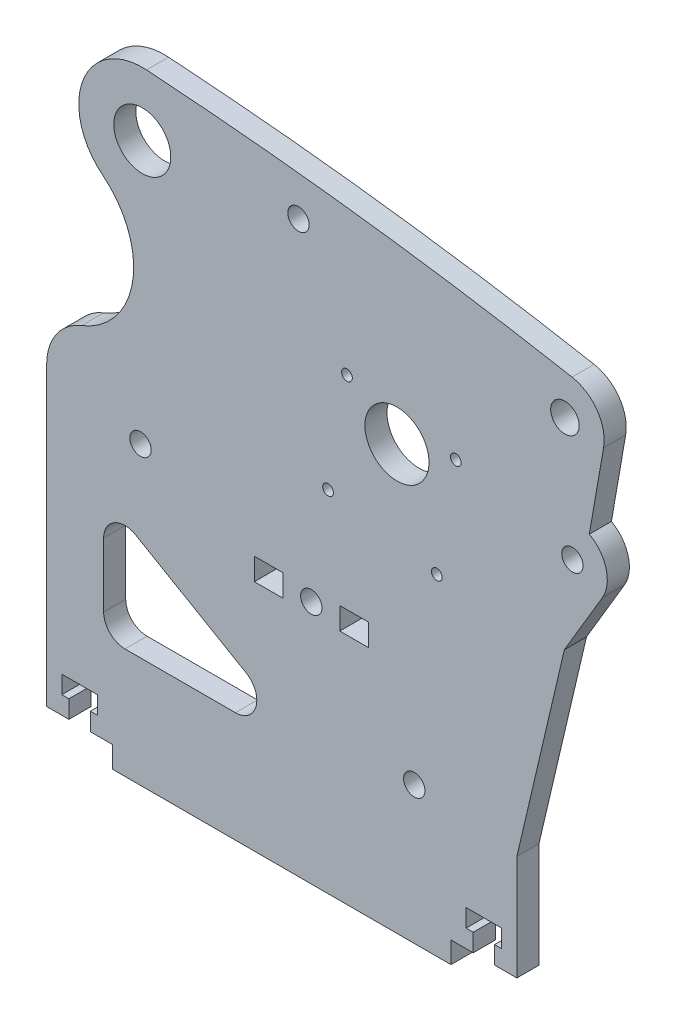
from build123d import *

# Parameters (mm, degrees)
SKETCH1_R           = 4
SKETCH1_R_2         = 8
SKETCH1_R_3         = 3
SKETCH1_R_4         = 9
BOSS_EXTRUDE1_DEPTH = 6.2
CUT_EXTRUDE1_REACH  = 156.506
SKETCH2_R           = 1.5
CUT_EXTRUDE2_REACH  = 156.506
CUT_EXTRUDE3_REACH  = 156.506
SKETCH4_R           = 3
SKETCH4_W           = 8
SKETCH4_H           = 6.2


with BuildPart() as part:
    # Sketch1 → Boss-Extrude1 (new body)
    with BuildSketch(Plane.XY):
        with BuildLine():
            Line((33.65, -83.5), (47, -26.5))
            Line((47, -26.5), (57.678304402, -8.5))
            ThreePointArc((57.678304402, -8.5), (58.708572703, -0.936463864), (54, 5.071686829))
            Line((54, 5.071686829), (58, 28.071686829))
            ThreePointArc((58, 28.071686829), (56.207110337, 36.277710094), (49.152329455, 40.836584722))
            ThreePointArc((49.152329455, 40.836584722), (-10.365453902, 50.052003716), (-70.318491494, 55.789927265))
            ThreePointArc((-70.318491494, 55.789927265), (-88.125314746, 44.440216148), (-82.611172846, 24.056567409))
            ThreePointArc((-82.611172846, 24.056567409), (-74.166284142, 2.579562371), (-88.533690885, -15.480213766))
            ThreePointArc((-88.533690885, -15.480213766), (-95.663024793, -21.178356395), (-98.35, -29.900534772))
            Line((-98.35, -29.900534772), (-98.35, -113))
            Line((-98.35, -113), (-79.85, -113))
            Line((-79.85, -113), (-79.85, -119))
            Line((-79.85, -119), (15.15, -119))
            Line((15.15, -119), (15.15, -113))
            Line((15.15, -113), (33.65, -113))
            Line((33.65, -113), (33.65, -83.5))
        make_face()
        with Locations(Location((47.15, 30, 0), (0, 0, 180))):
            Circle(SKETCH1_R, mode=Mode.SUBTRACT)
        with Locations(Location((-71.5, 38, 0), (0, 0, 180))):
            Circle(SKETCH1_R_2, mode=Mode.SUBTRACT)
        with Locations(Location((-27.65, 40.9, 0), (0, 0, 180))):
            Circle(SKETCH1_R_3, mode=Mode.SUBTRACT)
        with Locations(Location((4.85, -80.4, 0), (0, 0, 180))):
            Circle(SKETCH1_R_3, mode=Mode.SUBTRACT)
        with Locations(Location((49.25, -3.5, 0), (0, 0, 180))):
            Circle(SKETCH1_R_3, mode=Mode.SUBTRACT)
        with Locations(Location((-72, -36, 0), (0, 0, 180))):
            Circle(SKETCH1_R_3, mode=Mode.SUBTRACT)
        with Locations(Location((0, 0, 0), (0, 0, 180))):
            Circle(SKETCH1_R_4, mode=Mode.SUBTRACT)
        with BuildLine():
            Line((-82.35, -64), (-82.35, -82))
            ThreePointArc((-82.35, -82), (-80.592640687, -86.242640687), (-76.35, -88))
            Line((-76.35, -88), (-45.35, -88))
            ThreePointArc((-45.35, -88), (-39.556365472, -83.560063768), (-42.337186896, -76.81126632))
            Line((-42.337186896, -76.81126632), (-73.337186896, -58.81126632))
            ThreePointArc((-73.337186896, -58.81126632), (-79.343586593, -58.800150068), (-82.35, -64))
        make_face(mode=Mode.SUBTRACT)
    extrude(amount=BOSS_EXTRUDE1_DEPTH)

    # Sketch2 → Cut-Extrude1 (cut, up to next)
    with BuildSketch(Plane.XY.offset(6.2), mode=Mode.PRIVATE) as cut_extrude1_sk1:
        with Locations((-19.348702159, -20.792251556)):
            Circle(SKETCH2_R)
    cut_extrude1_tool1 = extrude(cut_extrude1_sk1.sketch, amount=-CUT_EXTRUDE1_REACH, mode=Mode.PRIVATE) & part.part
    # Sketch2 → Cut-Extrude1 (cut, up to next)
    with BuildSketch(Plane.XY.offset(6.2), mode=Mode.PRIVATE) as cut_extrude1_sk2:
        with Locations((11.192862241, -26.103827973)):
            Circle(SKETCH2_R)
    cut_extrude1_tool2 = extrude(cut_extrude1_sk2.sketch, amount=-CUT_EXTRUDE1_REACH, mode=Mode.PRIVATE) & part.part
    # Sketch2 → Cut-Extrude1 (cut, up to next)
    with BuildSketch(Plane.XY.offset(6.2), mode=Mode.PRIVATE) as cut_extrude1_sk3:
        with Locations((-14.037125741, 9.749312843)):
            Circle(SKETCH2_R)
    cut_extrude1_tool3 = extrude(cut_extrude1_sk3.sketch, amount=-CUT_EXTRUDE1_REACH, mode=Mode.PRIVATE) & part.part
    # Sketch2 → Cut-Extrude1 (cut, up to next)
    with BuildSketch(Plane.XY.offset(6.2), mode=Mode.PRIVATE) as cut_extrude1_sk4:
        with Locations((16.504438658, 4.437736426)):
            Circle(SKETCH2_R)
    cut_extrude1_tool4 = extrude(cut_extrude1_sk4.sketch, amount=-CUT_EXTRUDE1_REACH, mode=Mode.PRIVATE) & part.part
    add(cut_extrude1_tool1.solids().sort_by_distance((-19.348702, -20.792252, 6.2))[0], mode=Mode.SUBTRACT)
    add(cut_extrude1_tool2.solids().sort_by_distance((11.192862, -26.103828, 6.2))[0], mode=Mode.SUBTRACT)
    add(cut_extrude1_tool3.solids().sort_by_distance((-14.037126, 9.749313, 6.2))[0], mode=Mode.SUBTRACT)
    add(cut_extrude1_tool4.solids().sort_by_distance((16.504439, 4.437736, 6.2))[0], mode=Mode.SUBTRACT)

    # Sketch3 → Cut-Extrude2 (cut, up to next)
    with BuildSketch(Plane(origin=(0, 0, 0), x_dir=(-1, 0, 0), z_dir=(0, 0, -1)), mode=Mode.PRIVATE) as cut_extrude2_sk1:
        Polygon((-29.4, -103), (-19.4, -103), (-19.4, -108), (-21.4, -108), (-21.4, -113), (-27.4, -113), (-27.4, -108), (-29.4, -108), align=None)
    cut_extrude2_tool1 = extrude(cut_extrude2_sk1.sketch, amount=-CUT_EXTRUDE2_REACH, mode=Mode.PRIVATE) & part.part
    # Sketch3 → Cut-Extrude2 (cut, up to next)
    with BuildSketch(Plane(origin=(0, 0, 0), x_dir=(-1, 0, 0), z_dir=(0, 0, -1)), mode=Mode.PRIVATE) as cut_extrude2_sk2:
        Polygon((92.1, -113), (86.1, -113), (86.1, -108), (84.1, -108), (84.1, -103), (94.1, -103), (94.1, -108), (92.1, -108), align=None)
    cut_extrude2_tool2 = extrude(cut_extrude2_sk2.sketch, amount=-CUT_EXTRUDE2_REACH, mode=Mode.PRIVATE) & part.part
    add(cut_extrude2_tool1.solids().sort_by_distance((24.4, -107.375, 0))[0], mode=Mode.SUBTRACT)
    add(cut_extrude2_tool2.solids().sort_by_distance((-89.1, -107.375, 0))[0], mode=Mode.SUBTRACT)

    # Sketch4 → Cut-Extrude3 (cut, up to next)
    with BuildSketch(Plane.XY.offset(6.2), mode=Mode.PRIVATE) as cut_extrude3_sk1:
        with Locations((-24.05, -50.4)):
            Circle(SKETCH4_R)
    cut_extrude3_tool1 = extrude(cut_extrude3_sk1.sketch, amount=-CUT_EXTRUDE3_REACH, mode=Mode.PRIVATE) & part.part
    # Sketch4 → Cut-Extrude3 (cut, up to next)
    with BuildSketch(Plane.XY.offset(6.2), mode=Mode.PRIVATE) as cut_extrude3_sk2:
        with Locations((-36.05, -50.4)):
            Rectangle(SKETCH4_W, SKETCH4_H)
    cut_extrude3_tool2 = extrude(cut_extrude3_sk2.sketch, amount=-CUT_EXTRUDE3_REACH, mode=Mode.PRIVATE) & part.part
    # Sketch4 → Cut-Extrude3 (cut, up to next)
    with BuildSketch(Plane.XY.offset(6.2), mode=Mode.PRIVATE) as cut_extrude3_sk3:
        with Locations((-12.05, -50.4)):
            Rectangle(SKETCH4_W, SKETCH4_H)
    cut_extrude3_tool3 = extrude(cut_extrude3_sk3.sketch, amount=-CUT_EXTRUDE3_REACH, mode=Mode.PRIVATE) & part.part
    add(cut_extrude3_tool1.solids().sort_by_distance((-24.05, -50.4, 6.2))[0], mode=Mode.SUBTRACT)
    add(cut_extrude3_tool2.solids().sort_by_distance((-36.05, -50.4, 6.2))[0], mode=Mode.SUBTRACT)
    add(cut_extrude3_tool3.solids().sort_by_distance((-12.05, -50.4, 6.2))[0], mode=Mode.SUBTRACT)


solid = part.part
